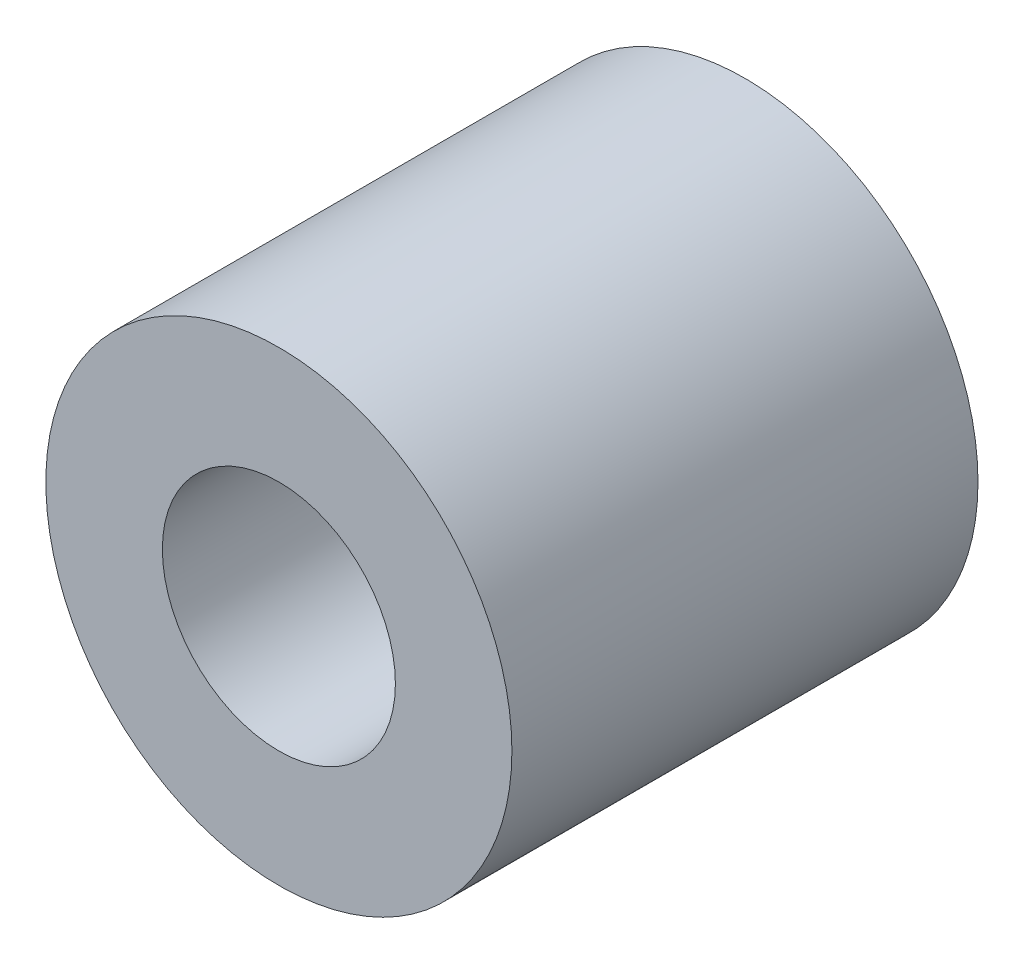
from build123d import *

# Parameters (mm, degrees)
SKETCH2_R           = 5
BOSS_EXTRUDE1_DEPTH = 10
CUT_EXTRUDE1_REACH  = 14.247
SKETCH3_R           = 2.5


with BuildPart() as part:
    # Sketch2 → Boss-Extrude1 (new body)
    with BuildSketch(Plane.XY):
        Circle(SKETCH2_R)
    extrude(amount=BOSS_EXTRUDE1_DEPTH)

    # Sketch3 → Cut-Extrude1 (cut, up to next)
    with BuildSketch(Plane.XY.offset(10), mode=Mode.PRIVATE) as cut_extrude1_sk1:
        Circle(SKETCH3_R)
    cut_extrude1_tool1 = extrude(cut_extrude1_sk1.sketch, amount=-CUT_EXTRUDE1_REACH, mode=Mode.PRIVATE) & part.part
    add(cut_extrude1_tool1.solids().sort_by_distance((0, 0, 10))[0], mode=Mode.SUBTRACT)


solid = part.part
